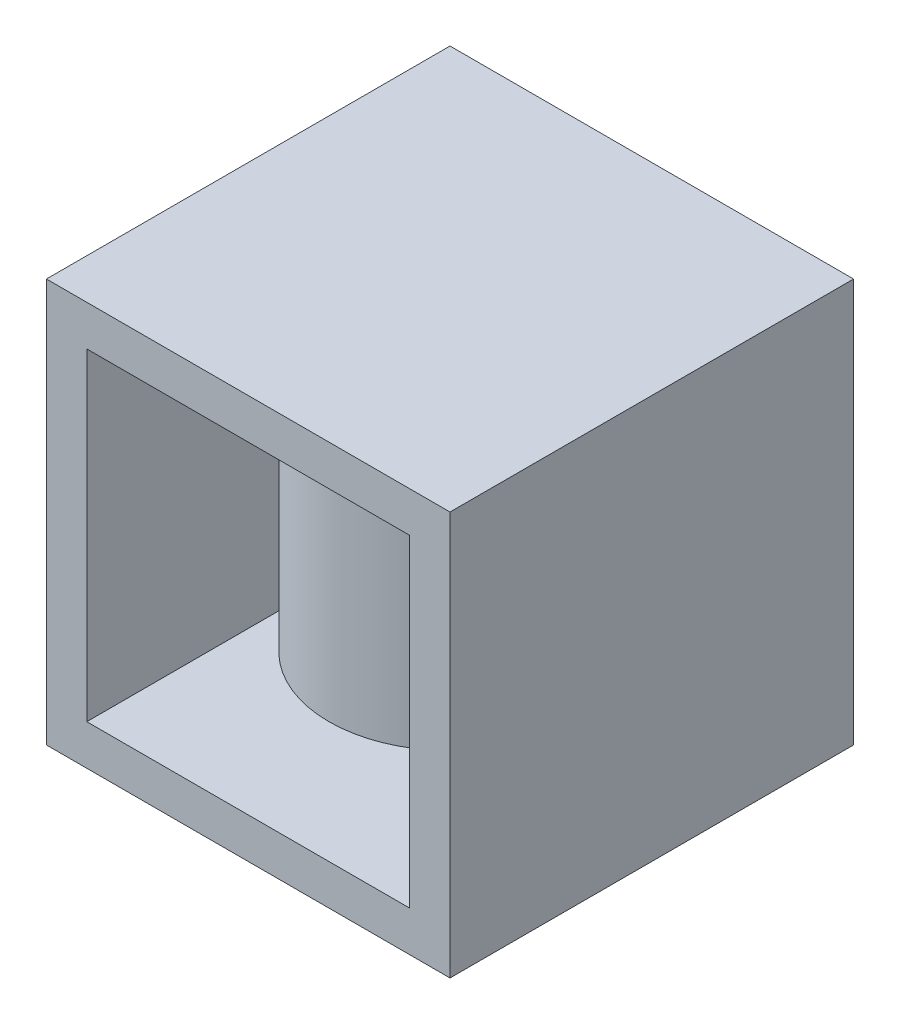
from build123d import *

# Parameters (mm, degrees)
SKETCH1_W           = 1000
SKETCH1_H           = 1000
SKETCH1_W_2         = 800
SKETCH1_H_2         = 800
BOSS_EXTRUDE1_DEPTH = 1000
SKETCH2_R           = 300
BOSS_EXTRUDE2_DEPTH = 700


with BuildPart() as part:
    # Sketch1 → Boss-Extrude1 (new body)
    with BuildSketch(Plane.XY):
        with Locations((500, 500)):
            Rectangle(SKETCH1_W, SKETCH1_H)
        with Locations((500, 500)):
            Rectangle(SKETCH1_W_2, SKETCH1_H_2, mode=Mode.SUBTRACT)
    extrude(amount=BOSS_EXTRUDE1_DEPTH)

    # Sketch2 → Boss-Extrude2 (add)
    with BuildSketch(Plane.XZ.offset(-900)):
        with Locations(Location((500, 500, 0), (0, 0, 90))):
            Circle(SKETCH2_R)
    extrude(amount=BOSS_EXTRUDE2_DEPTH)


solid = part.part
